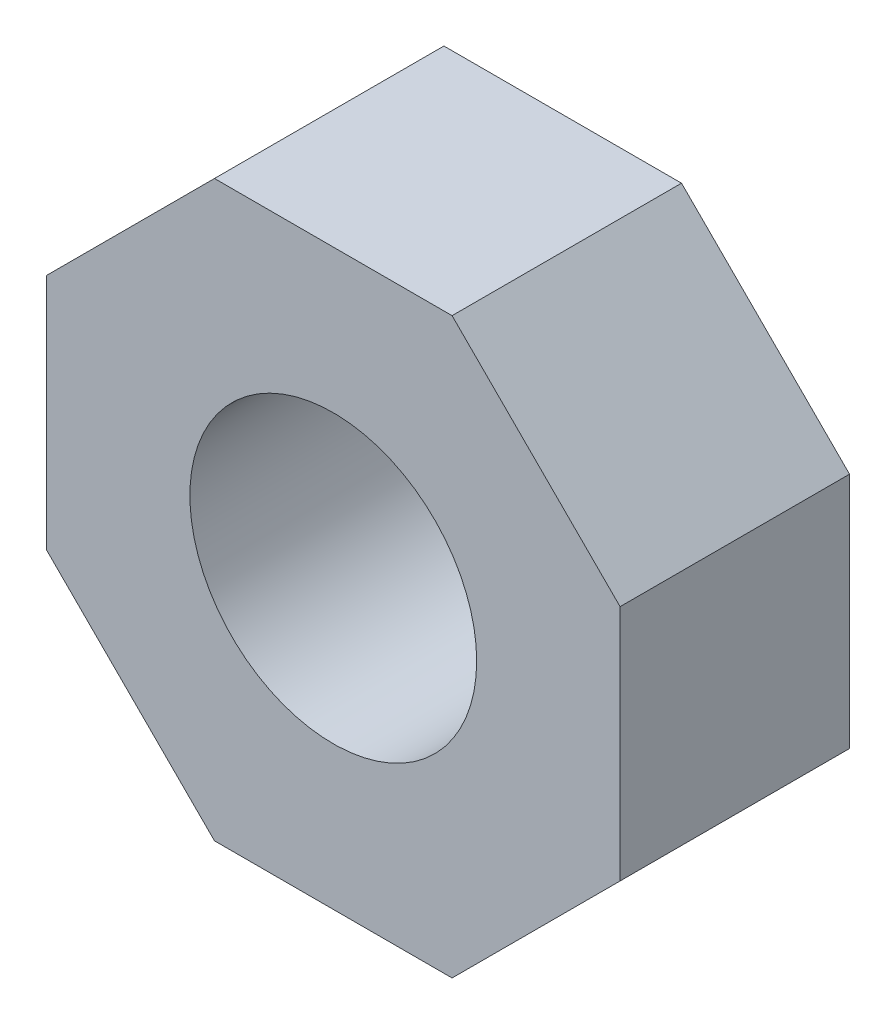
from build123d import *

# Parameters (mm, degrees)
ESQUISSE1_R        = 2.5
BOSS_EXTRU_1_DEPTH = 4


with BuildPart() as part:
    # Esquisse1 → Boss.-Extru.1 (new body)
    with BuildSketch(Plane.XY):
        Polygon((-5, -2.071067812), (-3.535533906, -3.535533906), (-2.071067812, -5), (2.071067812, -5), (3.535533906, -3.535533906), (5, -2.071067812), (5, 2.071067812), (3.535533906, 3.535533906), (2.071067812, 5), (-2.071067812, 5), (-3.535533906, 3.535533906), (-5, 2.071067812), (-5, 0), align=None)
        Circle(ESQUISSE1_R, mode=Mode.SUBTRACT)
    extrude(amount=BOSS_EXTRU_1_DEPTH)


solid = part.part
